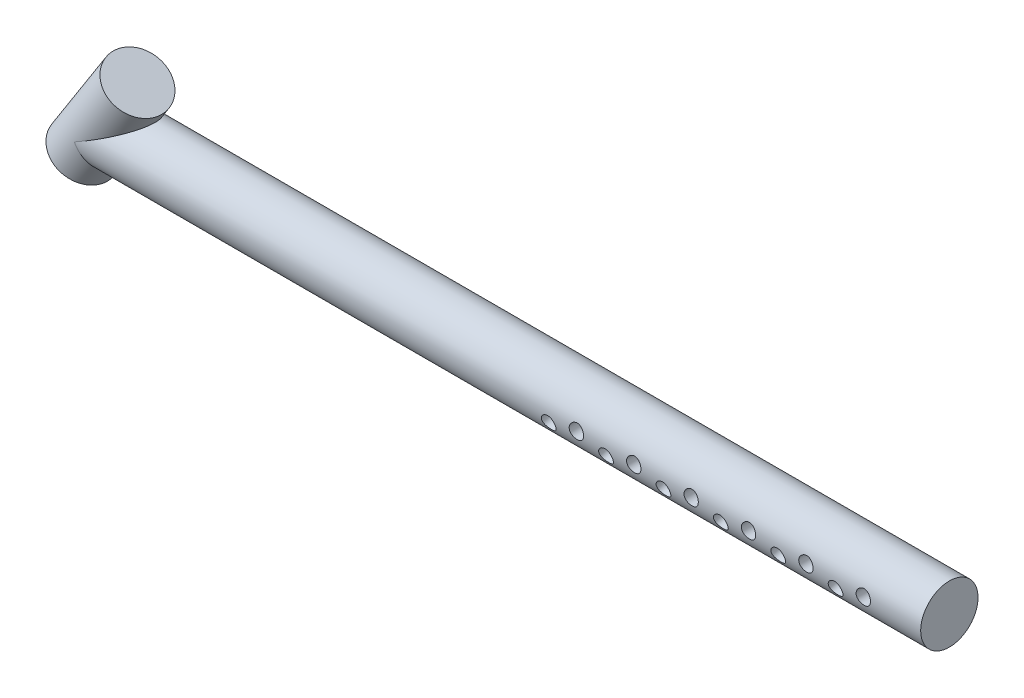
from build123d import *

# Parameters (mm, degrees)
SWEEP1_PROFILE_R   = 12.7
SWEEP2_PROFILE_R   = 12.7
SKETCH18_R         = 3.175
CUT_EXTRUDE1_DEPTH = 396.366403654
SKETCH23_R         = 3.175
CUT_EXTRUDE2_DEPTH = 396.366403657
LPATTERN1_COUNT    = 6
LPATTERN1_PITCH    = 25.4


with BuildPart() as part:
    # Sweep1: sweep along a path in Sketch1
    with BuildLine(Plane.XY) as sweep1_path:
        Line((0, 0), (-374.65, 0))
    # Sweep1 profile (on start of the path) → Sweep1 (sweep)
    with BuildSketch(Plane(origin=(0, 0, 0), x_dir=(0, 0, -1), z_dir=(-1, 0, 0))):
        Circle(SWEEP1_PROFILE_R)
    sweep(path=sweep1_path.line)

    # Sweep2: sweep along a path in Sketch1<3>
    with BuildLine(Plane.XY) as sweep2_path:
        Line((-359.364900742, 23.99279985), (-383.247868333, -13.495949916))
    # Sweep2 profile (on start of the path) → Sweep2 (sweep)
    with BuildSketch(Plane(origin=(-359.364900742, 23.99279985, 0), x_dir=(-0.8433914458128872, 0.5372996083468216, 0), z_dir=(-0.5372996083468216, -0.8433914458128872, 0))):
        Circle(SWEEP2_PROFILE_R)
    sweep(path=sweep2_path.line)

    # Sketch18 → Cut-Extrude1 (cut, symmetric)
    with BuildSketch(Plane.XY):
        with Locations((-25.4, 0)):
            Circle(SKETCH18_R)
    cut_extrude1 = extrude(amount=CUT_EXTRUDE1_DEPTH, both=True, mode=Mode.SUBTRACT)

    # Sketch23 → Cut-Extrude2 (cut, symmetric)
    with BuildSketch(Plane(origin=(0, 0, 0), x_dir=(-1, 0, 0), z_dir=(0, -0.2588190451025213, 0.9659258262890681))):
        with Locations((38.1, 0)):
            Circle(SKETCH23_R)
    cut_extrude2 = extrude(amount=CUT_EXTRUDE2_DEPTH, both=True, mode=Mode.SUBTRACT)

    # LPattern1: Cut-Extrude1, Cut-Extrude2 ×6
    with Locations(*[(-i * LPATTERN1_PITCH, 0, 0) for i in range(1, LPATTERN1_COUNT)]):
        add(cut_extrude1, mode=Mode.SUBTRACT)
        add(cut_extrude2, mode=Mode.SUBTRACT)


solid = part.part
